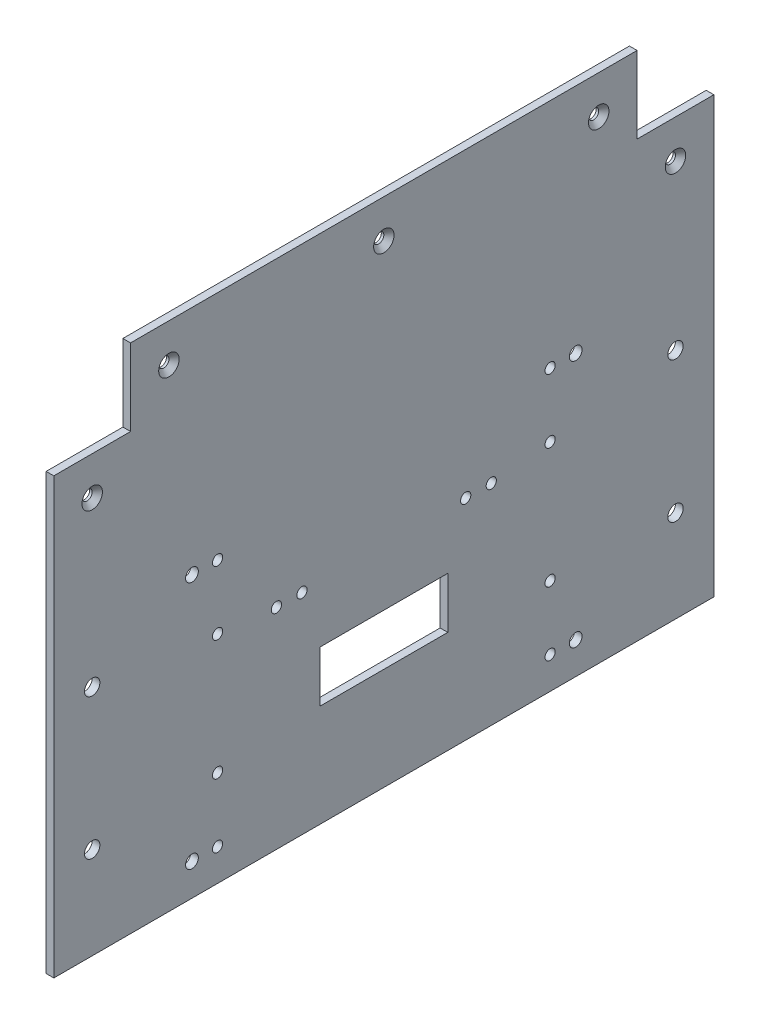
from build123d import *

# Parameters (mm, degrees)
SKETCH_1_W          = 258
SKETCH_1_H          = 200
EXTRUDE_1_DEPTH     = 3
SKETCH_2_R          = 3
SKETCH_2_R_2        = 2
SKETCH_2_R_3        = 2.5
SKETCH_2_W          = 30
SKETCH_2_H          = 30
SKETCH_2_W_2        = 50
SKETCH_2_H_2        = 20
CUT_EXTRUDE_2_DEPTH = 3
CHAMFER_2_SIZE      = 2


with BuildPart() as part:
    # 草图1 → 凸台-拉伸1 (new body)
    with BuildSketch(Plane(origin=(0, 0, 0), x_dir=(0, 0, -1), z_dir=(1, 0, 0))):
        Rectangle(SKETCH_1_W, SKETCH_1_H)
    extrude(amount=EXTRUDE_1_DEPTH)

    # 草图2 → 切除-拉伸2 (cut)
    with BuildSketch(Plane(origin=(0, 0, 0), x_dir=(0, 0, -1), z_dir=(1, 0, 0))):
        with Locations((-114, -9)):
            Circle(SKETCH_2_R)
        with Locations((-114, -64)):
            Circle(SKETCH_2_R)
        with Locations(Location((114, -64, 0), (0, 0, 180))):
            Circle(SKETCH_2_R)
        with Locations(Location((114, -9, 0), (0, 0, 180))):
            Circle(SKETCH_2_R)
        with Locations((-32, -18)):
            Circle(SKETCH_2_R_2)
        with Locations(Location((32, -18, 0), (0, 0, 180))):
            Circle(SKETCH_2_R_2)
        with Locations((-42, -18)):
            Circle(SKETCH_2_R_2)
        with Locations(Location((42, -18, 0), (0, 0, 180))):
            Circle(SKETCH_2_R_2)
        with Locations((-75, -87.5)):
            Circle(SKETCH_2_R_3)
        with Locations((-75, 9.5)):
            Circle(SKETCH_2_R_3)
        with Locations(Location((75, -87.5, 0), (0, 0, 180))):
            Circle(SKETCH_2_R_3)
        with Locations(Location((75, 9.5, 0), (0, 0, 180))):
            Circle(SKETCH_2_R_3)
        with Locations((-65, 9.5)):
            Circle(SKETCH_2_R_2)
        with Locations((-65, -15.5)):
            Circle(SKETCH_2_R_2)
        with Locations((-65, -62.5)):
            Circle(SKETCH_2_R_2)
        with Locations((-65, -87.5)):
            Circle(SKETCH_2_R_2)
        with Locations(Location((65, -87.5, 0), (0, 0, 180))):
            Circle(SKETCH_2_R_2)
        with Locations(Location((65, -62.5, 0), (0, 0, 180))):
            Circle(SKETCH_2_R_2)
        with Locations(Location((65, -15.5, 0), (0, 0, 180))):
            Circle(SKETCH_2_R_2)
        with Locations(Location((65, 9.5, 0), (0, 0, 180))):
            Circle(SKETCH_2_R_2)
        with Locations((-114, 55)):
            Circle(SKETCH_2_R_2)
        with Locations((-84, 85)):
            Circle(SKETCH_2_R_2)
        with Locations((0, 85)):
            Circle(SKETCH_2_R_2)
        with Locations(Location((84, 85, 0), (0, 0, 180))):
            Circle(SKETCH_2_R_2)
        with Locations(Location((114, 55, 0), (0, 0, 180))):
            Circle(SKETCH_2_R_2)
        with Locations((114, 85)):
            Rectangle(SKETCH_2_W, SKETCH_2_H)
        with Locations((-114, 85)):
            Rectangle(SKETCH_2_W, SKETCH_2_H)
        with Locations((0, -50)):
            Rectangle(SKETCH_2_W_2, SKETCH_2_H_2)
    extrude(amount=CUT_EXTRUDE_2_DEPTH, mode=Mode.SUBTRACT)

    # 倒角2
    chamfer_2_edges = [part.edges().sort_by_distance(p)[0] for p in [
        (3, 85, 86),
        (3, 85, 2),
        (3, 55, 116),
        (3, 55, -116),
        (3, 85, -86),
    ]]
    chamfer(chamfer_2_edges, length=CHAMFER_2_SIZE)


solid = part.part
